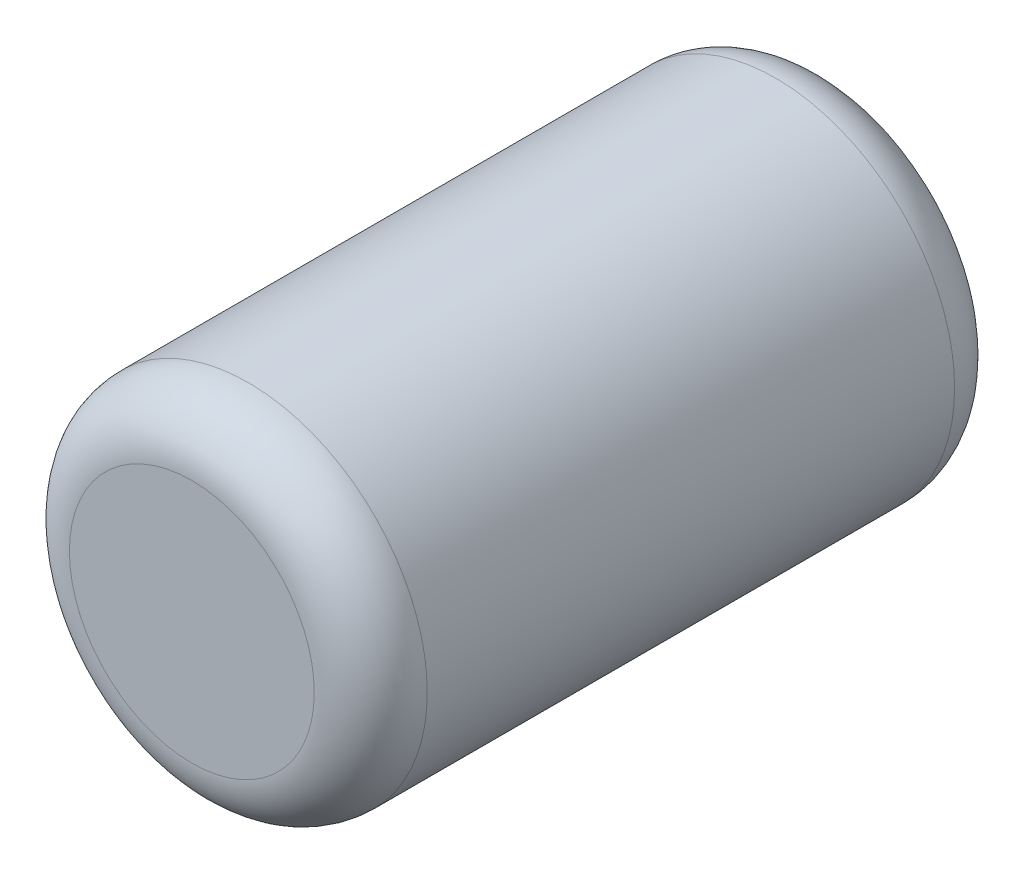
from build123d import *

# Parameters (mm, degrees)
SKETCH2_R           = 9.5
BOSS_EXTRUDE1_DEPTH = 34
FILLET1_R           = 3


with BuildPart() as part:
    # Sketch2 → Boss-Extrude1 (new body)
    with BuildSketch(Plane.XY):
        Circle(SKETCH2_R)
    extrude(amount=BOSS_EXTRUDE1_DEPTH)

    # Fillet1
    fillet1_edges = [part.edges().sort_by_distance(p)[0] for p in [
        (-9.5, 0, 0),
        (-9.5, 0, 34),
    ]]
    fillet(fillet1_edges, radius=FILLET1_R)


solid = part.part
